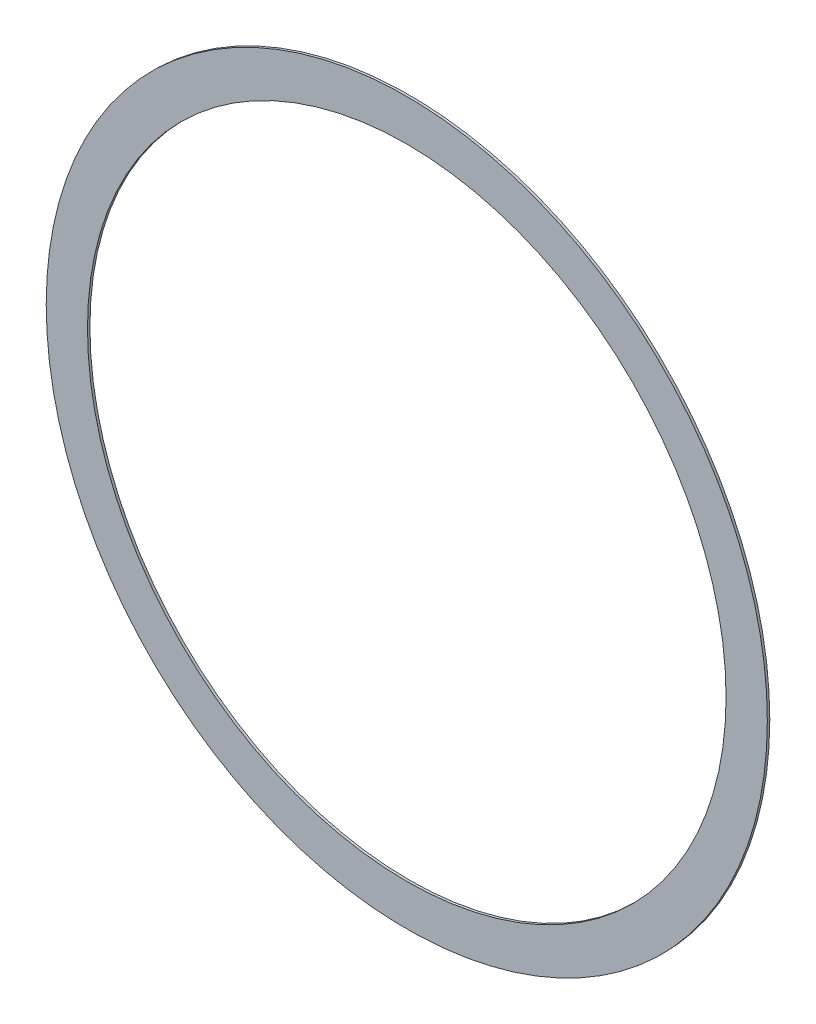
from build123d import *

# Parameters (mm, degrees)
SKETCH1_R           = 73.4
SKETCH1_R_2         = 65
BOSS_EXTRUDE1_DEPTH = 0.5


with BuildPart() as part:
    # Sketch1 → Boss-Extrude1 (new body)
    with BuildSketch(Plane.XY):
        Circle(SKETCH1_R)
        Circle(SKETCH1_R_2, mode=Mode.SUBTRACT)
    extrude(amount=BOSS_EXTRUDE1_DEPTH)


solid = part.part
